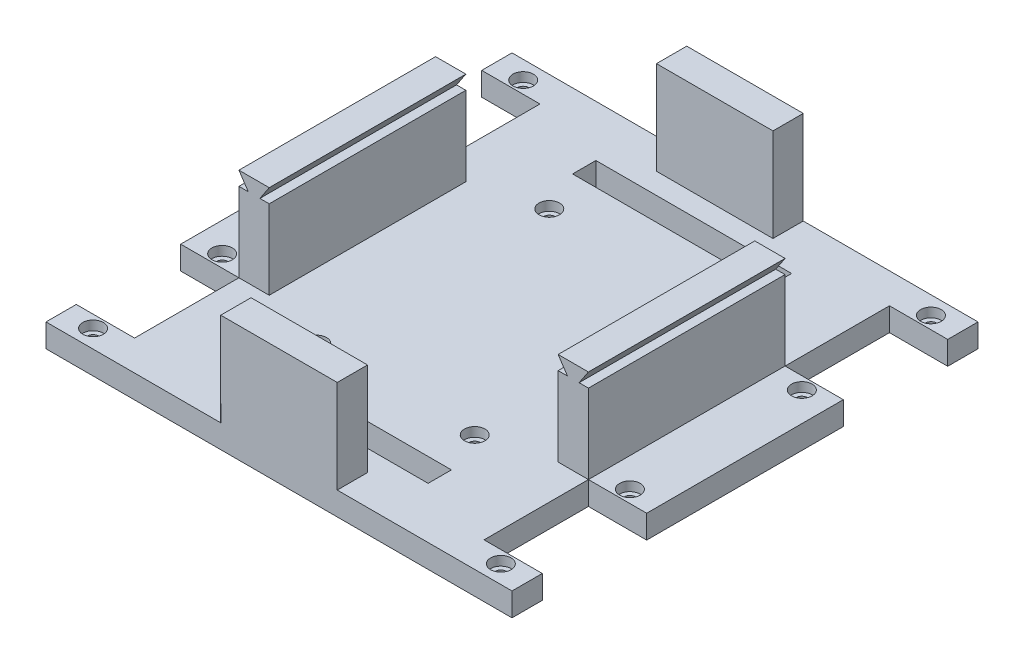
from build123d import *

# Parameters (mm, degrees)
SKETCH_1_W                   = 100
SKETCH_1_H                   = 100
EXTRUDE_1_DEPTH              = 5
CUT_EXTRUDE_1_REACH          = 72.887
SKETCH_2_W                   = 12.5
SKETCH_2_H                   = 22.4
HOLE_WIZARD_M2_3_D           = 2.4
HOLE_WIZARD_M2_3_CBORE_D     = 4.4
HOLE_WIZARD_M2_3_CBORE_DEPTH = 2
SKETCH_9_W                   = 25
SKETCH_9_H                   = 6.5
SKETCH_9_W_2                 = 6.5
SKETCH_9_H_2                 = 42.2
EXTRUDE_4_DEPTH              = 20
HOLE_WIZARD_M2_4_D           = 2.4
HOLE_WIZARD_M2_4_CBORE_D     = 4.4
HOLE_WIZARD_M2_4_CBORE_DEPTH = 2
SKETCH_12_W                  = 42
SKETCH_12_H                  = 5
CUT_EXTRUDE_2_DEPTH          = 10
CUT_EXTRUDE_3_DEPTH          = 91.444513377


with BuildPart() as part:
    # 草图1 → 凸台-拉伸1 (new body)
    with BuildSketch(Plane(origin=(0, 0, 0), x_dir=(1, 0, 0), z_dir=(0, 1, 0))):
        Rectangle(SKETCH_1_W, SKETCH_1_H)
    extrude(amount=EXTRUDE_1_DEPTH)

    # 草图2 → 切除-拉伸1 (cut, up to next)
    with BuildSketch(Plane(origin=(0, 5, 0), x_dir=(1, 0, 0), z_dir=(0, 1, 0)), mode=Mode.PRIVATE) as cut_extrude_1_sk1:
        with Locations((-43.75, 32.3)):
            Rectangle(SKETCH_2_W, SKETCH_2_H)
    cut_extrude_1_tool1 = extrude(cut_extrude_1_sk1.sketch, amount=-CUT_EXTRUDE_1_REACH, mode=Mode.PRIVATE) & part.part
    # 草图2 → 切除-拉伸1 (cut, up to next)
    with BuildSketch(Plane(origin=(0, 5, 0), x_dir=(1, 0, 0), z_dir=(0, 1, 0)), mode=Mode.PRIVATE) as cut_extrude_1_sk2:
        with Locations((43.75, 32.3)):
            Rectangle(SKETCH_2_W, SKETCH_2_H)
    cut_extrude_1_tool2 = extrude(cut_extrude_1_sk2.sketch, amount=-CUT_EXTRUDE_1_REACH, mode=Mode.PRIVATE) & part.part
    # 草图2 → 切除-拉伸1 (cut, up to next)
    with BuildSketch(Plane(origin=(0, 5, 0), x_dir=(1, 0, 0), z_dir=(0, 1, 0)), mode=Mode.PRIVATE) as cut_extrude_1_sk3:
        with Locations((43.75, -32.3)):
            Rectangle(SKETCH_2_W, SKETCH_2_H)
    cut_extrude_1_tool3 = extrude(cut_extrude_1_sk3.sketch, amount=-CUT_EXTRUDE_1_REACH, mode=Mode.PRIVATE) & part.part
    # 草图2 → 切除-拉伸1 (cut, up to next)
    with BuildSketch(Plane(origin=(0, 5, 0), x_dir=(1, 0, 0), z_dir=(0, 1, 0)), mode=Mode.PRIVATE) as cut_extrude_1_sk4:
        with Locations((-43.75, -32.3)):
            Rectangle(SKETCH_2_W, SKETCH_2_H)
    cut_extrude_1_tool4 = extrude(cut_extrude_1_sk4.sketch, amount=-CUT_EXTRUDE_1_REACH, mode=Mode.PRIVATE) & part.part
    add(cut_extrude_1_tool1.solids().sort_by_distance((-43.75, 5, -32.3))[0], mode=Mode.SUBTRACT)
    add(cut_extrude_1_tool2.solids().sort_by_distance((43.75, 5, -32.3))[0], mode=Mode.SUBTRACT)
    add(cut_extrude_1_tool3.solids().sort_by_distance((43.75, 5, 32.3))[0], mode=Mode.SUBTRACT)
    add(cut_extrude_1_tool4.solids().sort_by_distance((-43.75, 5, 32.3))[0], mode=Mode.SUBTRACT)

    # M2 凹头盖螺钉的柱形沉头孔3 (through all)
    with Locations(Plane(origin=(-43.75, 5, -46.15), x_dir=(0, 0, 1), z_dir=(0, 1, 0))):
        with Locations((0, 0), (0, 87.5), (27.7, 87.5), (27.7, 0), (64.6, 0), (92.3, 0), (64.6, 87.5), (92.3, 87.5)):
            CounterBoreHole(HOLE_WIZARD_M2_3_D / 2, HOLE_WIZARD_M2_3_CBORE_D / 2, HOLE_WIZARD_M2_3_CBORE_DEPTH)

    # 草图9 → 凸台-拉伸4 (add)
    with BuildSketch(Plane(origin=(0, 5, 0), x_dir=(1, 0, 0), z_dir=(0, 1, 0))):
        with Locations((0, 46.75)):
            Rectangle(SKETCH_9_W, SKETCH_9_H)
        with Locations((0, -46.75)):
            Rectangle(SKETCH_9_W, SKETCH_9_H)
        with Locations((-34.25, 0)):
            Rectangle(SKETCH_9_W_2, SKETCH_9_H_2)
        with Locations((34.25, 0)):
            Rectangle(SKETCH_9_W_2, SKETCH_9_H_2)
    extrude(amount=EXTRUDE_4_DEPTH)

    # M2 凹头盖螺钉的柱形沉头孔4 (through all)
    with Locations(Plane(origin=(-17, 5, -25), x_dir=(0, 0, 1), z_dir=(0, 1, 0))):
        with Locations((0, 0), (0, 34), (50, 0), (50, 34)):
            CounterBoreHole(HOLE_WIZARD_M2_4_D / 2, HOLE_WIZARD_M2_4_CBORE_D / 2, HOLE_WIZARD_M2_4_CBORE_DEPTH)

    # 草图12 → 切除-拉伸2 (cut)
    with BuildSketch(Plane(origin=(0, 5, 0), x_dir=(1, 0, 0), z_dir=(0, 1, 0))):
        with Locations((0, 36.5)):
            Rectangle(SKETCH_12_W, SKETCH_12_H)
        with Locations((0, -36.5)):
            Rectangle(SKETCH_12_W, SKETCH_12_H)
    extrude(amount=-CUT_EXTRUDE_2_DEPTH, mode=Mode.SUBTRACT)

    # 草图15 → 切除-拉伸3 (cut, through all)
    with BuildSketch(Plane.XY.offset(21.1)):
        Polygon((-37.5, 25), (-37.5, 22), (-35.5, 22), align=None)
        Polygon((-31, 25), (-31, 22), (-33, 22), align=None)
        Polygon((37.5, 25), (37.5, 22), (35.5, 22), align=None)
        Polygon((31, 22), (33, 22), (31, 25), align=None)
    extrude(amount=-CUT_EXTRUDE_3_DEPTH, mode=Mode.SUBTRACT)


solid = part.part
